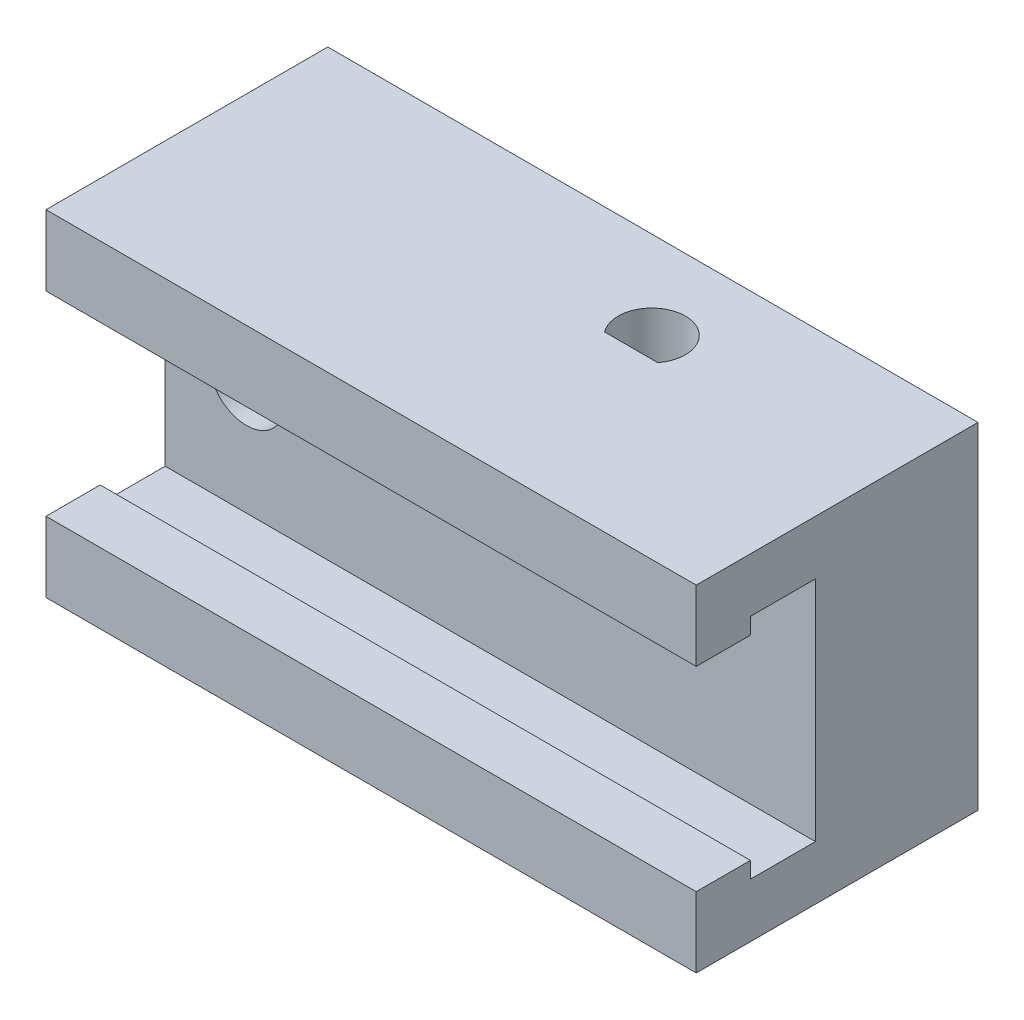
from build123d import *

# Parameters (mm, degrees)
SKETCH1_W           = 30
SKETCH1_H           = 13
BOSS_EXTRUDE1_DEPTH = 15.5
CUT_EXTRUDE1_DEPTH  = 35.933544052
SKETCH3_R           = 1.75
CUT_EXTRUDE2_DEPTH  = 28.753378173


with BuildPart() as part:
    # Sketch1 → Boss-Extrude1 (new body)
    with BuildSketch(Plane(origin=(0, 0, 0), x_dir=(1, 0, 0), z_dir=(0, 1, 0))):
        with Locations((-4, -2.45)):
            Rectangle(SKETCH1_W, SKETCH1_H)
        with BuildLine():
            Line((-1.224744871, -0.95), (1.224744871, -0.95))
            ThreePointArc((1.224744871, -0.95), (0, 1.55), (-1.224744871, -0.95))
        make_face(mode=Mode.SUBTRACT)
    extrude(amount=BOSS_EXTRUDE1_DEPTH)

    # Sketch2 → Cut-Extrude1 (cut, through all)
    with BuildSketch(Plane.ZY.offset(19)):
        Polygon((8.95, 12.25), (6.45, 12.25), (6.45, 13), (3.45, 13), (3.45, 2.5), (6.45, 2.5), (6.45, 3.25), (8.95, 3.25), align=None)
    extrude(amount=-CUT_EXTRUDE1_DEPTH, mode=Mode.SUBTRACT)

    # Sketch3 → Cut-Extrude2 (cut, through all)
    with BuildSketch(Plane(origin=(0, 0, -4.05), x_dir=(-1, 0, 0), z_dir=(0, 0, -1))):
        with Locations((15.25, 7.75)):
            Circle(SKETCH3_R)
    extrude(amount=-CUT_EXTRUDE2_DEPTH, mode=Mode.SUBTRACT)


solid = part.part
